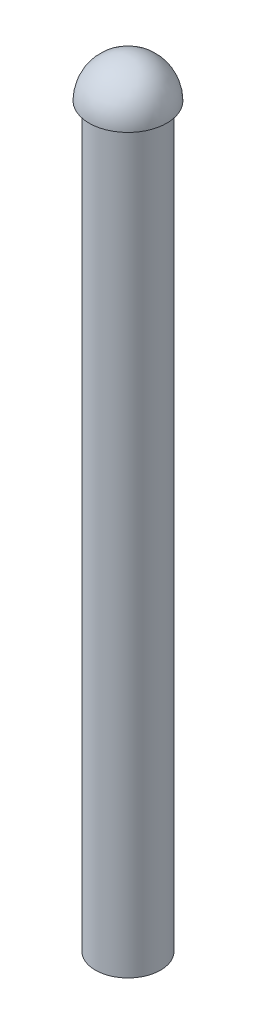
from build123d import *

# Parameters (mm, degrees)
REVOLVE_1_ANGLE              = 180
SKETCH_6_W                   = 6.5
SKETCH_6_H                   = 146.9
HOLE_WIZARD_M8_1_D           = 6.8
HOLE_WIZARD_M8_1_DEPTH       = 19.75
HOLE_WIZARD_M8_1_CSINK_D     = 8.05
HOLE_WIZARD_M8_1_CSINK_ANGLE = 90
HOLE_WIZARD_M8_1_TIP         = 2.042926105


with BuildPart() as part:
    # 草图1 → 旋转1 (revolve)
    with BuildSketch(Plane(origin=(0, 0, 0), x_dir=(1, 0, 0), z_dir=(0, 1, 0))):
        with BuildLine():
            Line((0, 7.75), (0, -7.75))
            ThreePointArc((0, -7.75), (7.75, 0), (0, 7.75))
        make_face()
    revolve(axis=Axis((0, 0, -7.75), (0, 0, 1)), revolution_arc=REVOLVE_1_ANGLE)

    # 草图6 → 旋转2 (revolve)
    with BuildSketch(Plane(origin=(0, 0, 0), x_dir=(0, 0, -1), z_dir=(1, 0, 0)), mode=Mode.PRIVATE) as revolve_2_sk:
        with Locations((3.25, -73.45)):
            Rectangle(SKETCH_6_W, SKETCH_6_H)
    revolve(revolve_2_sk.sketch.rotate(Axis((0, 0, 0), (0, -1, 0)), 180), axis=Axis((0, 0, 0), (0, -1, 0)))

    # M8 螺纹孔1
    with Locations(Plane(origin=(0, -146.9, 0), x_dir=(0, 0, -1), z_dir=(0, -1, 0))):
        with Locations((0, 0)):
            CounterSinkHole(HOLE_WIZARD_M8_1_D / 2, HOLE_WIZARD_M8_1_CSINK_D / 2, depth=HOLE_WIZARD_M8_1_DEPTH, counter_sink_angle=HOLE_WIZARD_M8_1_CSINK_ANGLE)
            with Locations((0, 0, -(HOLE_WIZARD_M8_1_DEPTH + HOLE_WIZARD_M8_1_TIP / 2))):  # 118° drill point
                Cone(0, HOLE_WIZARD_M8_1_D / 2, HOLE_WIZARD_M8_1_TIP, mode=Mode.SUBTRACT)


solid = part.part
